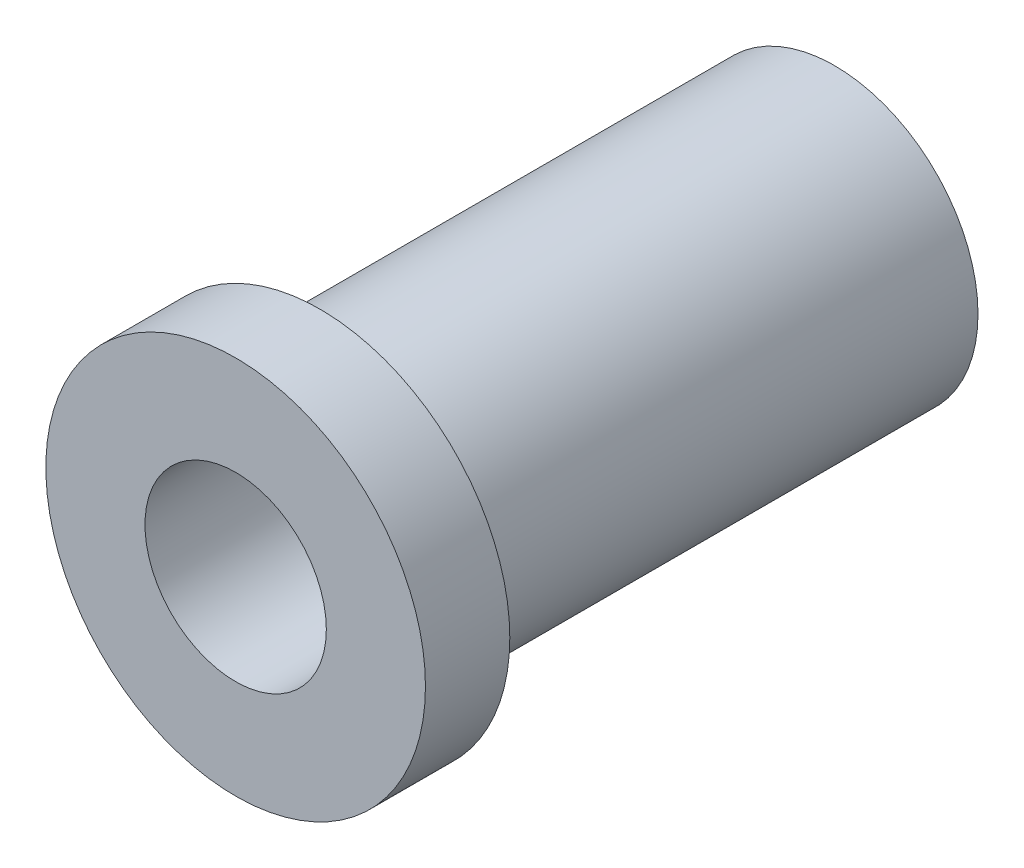
from build123d import *

# Parameters (mm, degrees)
SKETCH_1_R      = 3.4
SKETCH_1_R_2    = 2.15
EXTRUDE_1_DEPTH = 12.2
SKETCH_2_R      = 4.5
SKETCH_2_R_2    = 2.15
EXTRUDE_2_DEPTH = 2


with BuildPart() as part:
    # 草图1 → 凸台-拉伸1 (new body)
    with BuildSketch(Plane.XY):
        Circle(SKETCH_1_R)
        Circle(SKETCH_1_R_2, mode=Mode.SUBTRACT)
    extrude(amount=EXTRUDE_1_DEPTH)

    # 草图2 → 凸台-拉伸2 (add)
    with BuildSketch(Plane.XY.offset(12.2)):
        Circle(SKETCH_2_R)
        Circle(SKETCH_2_R_2, mode=Mode.SUBTRACT)
    extrude(amount=EXTRUDE_2_DEPTH)


solid = part.part
